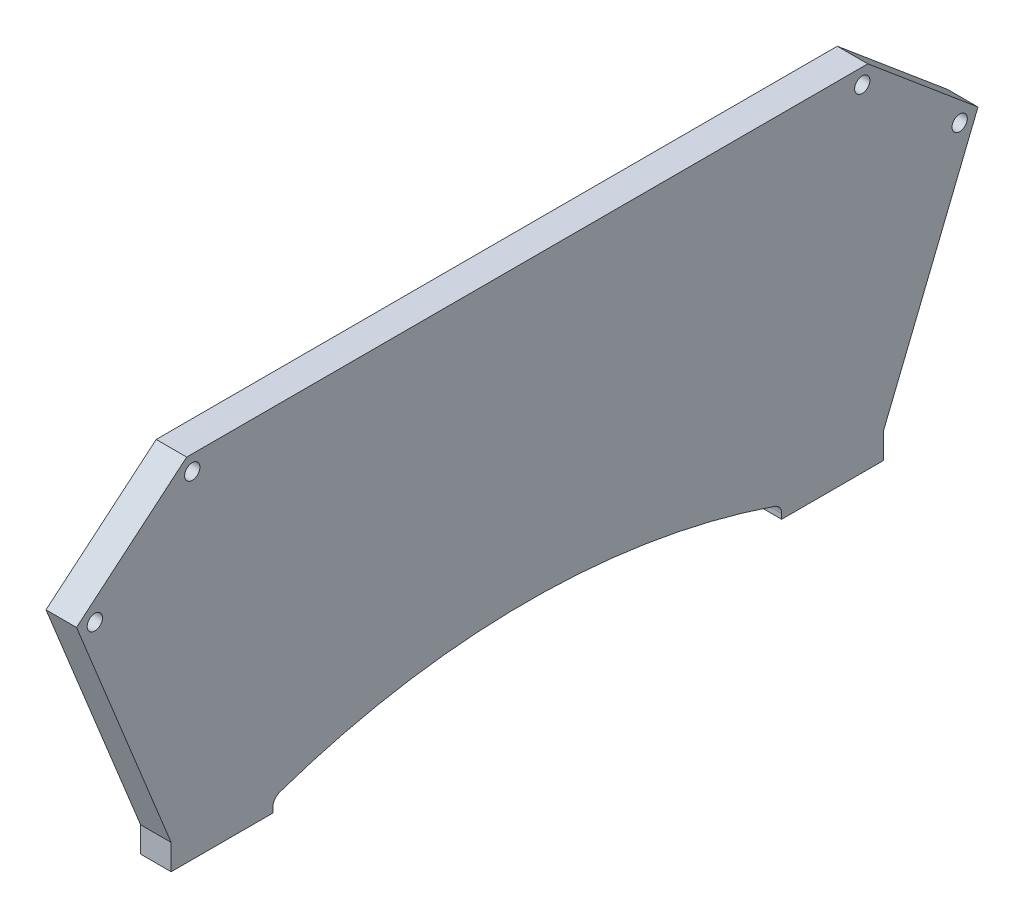
from build123d import *

# Parameters (mm, degrees)
SKETCH1_R                   = 1.5
BOSS_EXTRUDE1_DEPTH         = 6
TAP_DRILL_FOR_M3_TAP1_D     = 2.5
TAP_DRILL_FOR_M3_TAP1_DEPTH = 10
TAP_DRILL_FOR_M3_TAP1_TIP   = 0.751075774


with BuildPart() as part:
    # Sketch1 → Boss-Extrude1 (new body)
    with BuildSketch(Plane(origin=(0, 0, 0), x_dir=(0, 0, -1), z_dir=(1, 0, 0))):
        with BuildLine():
            Line((0, 0), (0, 5))
            Line((0, 5), (-18.599926487, 50.895524881))
            Line((-18.599926487, 50.895524881), (3.059200375, 69.069690242))
            Line((3.059200375, 69.069690242), (136.940799625, 69.069690242))
            Line((136.940799625, 69.069690242), (158.599926487, 50.895524881))
            Line((158.599926487, 50.895524881), (140, 5))
            Line((140, 5), (140, 0))
            Line((140, 0), (120, 0))
            Line((120, 0), (120, 1))
            ThreePointArc((120, 1), (119.627466942, 2.162476387), (118.648648649, 2.891891892))
            ThreePointArc((118.648648649, 2.891891892), (70, 11), (21.351351351, 2.891891892))
            ThreePointArc((21.351351351, 2.891891892), (20.372533058, 2.162476387), (20, 1))
            Line((20, 1), (20, 0))
            Line((20, 0), (0, 0))
        make_face()
        with Locations((-15, 50)):
            Circle(SKETCH1_R, mode=Mode.SUBTRACT)
        with Locations((155, 50)):
            Circle(SKETCH1_R, mode=Mode.SUBTRACT)
        with Locations((4.151111078, 66.069690242)):
            Circle(SKETCH1_R, mode=Mode.SUBTRACT)
        with Locations((135.848888922, 66.069690242)):
            Circle(SKETCH1_R, mode=Mode.SUBTRACT)
    extrude(amount=BOSS_EXTRUDE1_DEPTH)

    # Tap Drill for M3 Tap1
    with Locations(Plane(origin=(0, 0, 0), x_dir=(-1, 0, 0), z_dir=(0, -1, 0))):
        with Locations((-3, 10), (-3, 130)):
            Hole(TAP_DRILL_FOR_M3_TAP1_D / 2, depth=TAP_DRILL_FOR_M3_TAP1_DEPTH)
            with Locations((0, 0, -(TAP_DRILL_FOR_M3_TAP1_DEPTH + TAP_DRILL_FOR_M3_TAP1_TIP / 2))):  # 118° drill point
                Cone(0, TAP_DRILL_FOR_M3_TAP1_D / 2, TAP_DRILL_FOR_M3_TAP1_TIP, mode=Mode.SUBTRACT)


solid = part.part
